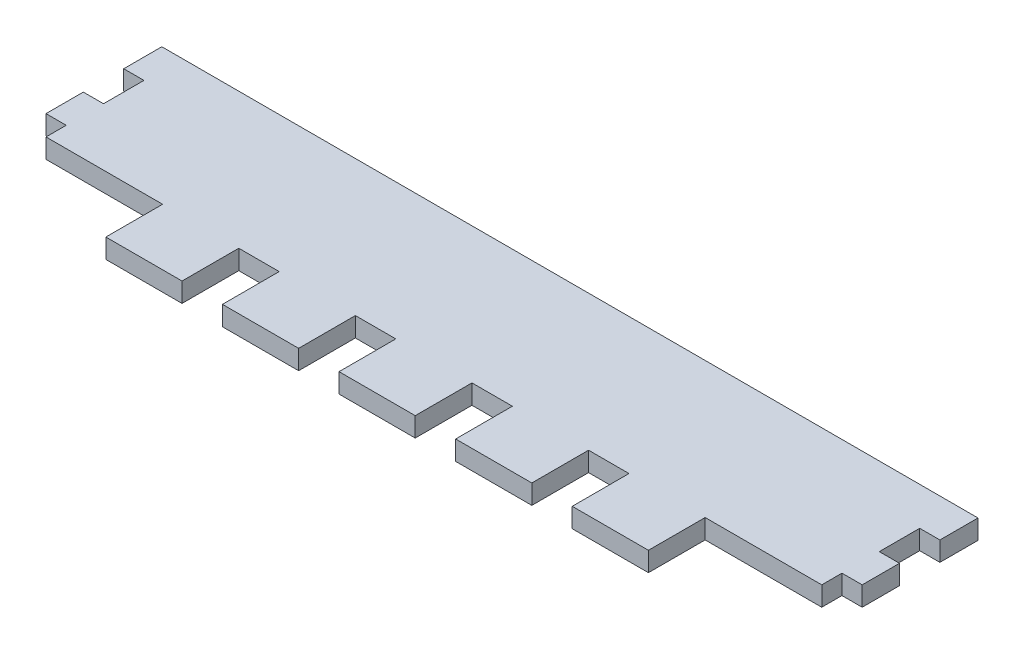
from build123d import *

# Parameters (mm, degrees)
SKETCH1_W           = 266.7
SKETCH1_H           = 57.15
BOSS_EXTRUDE1_DEPTH = 6.35
SKETCH3_W           = 24.892
SKETCH3_H           = 18.542
BOSS_EXTRUDE2_DEPTH = 6.35
SKETCH4_W           = 13.208
SKETCH4_H           = 13.208
CUT_EXTRUDE2_DEPTH  = 142.5717369
SKETCH5_W           = 295.464136086
SKETCH5_H           = 12.7
CUT_EXTRUDE3_DEPTH  = 142.5717369
SKETCH6_W           = 266.7
SKETCH6_H           = 12.446
BOSS_EXTRUDE3_DEPTH = 6.35


with BuildPart() as part:
    # Sketch1 → Boss-Extrude1 (new body)
    with BuildSketch(Plane(origin=(0, 0, 0), x_dir=(1, 0, 0), z_dir=(0, 1, 0))):
        Rectangle(SKETCH1_W, SKETCH1_H)
    extrude(amount=BOSS_EXTRUDE1_DEPTH)

    # Sketch3 → Boss-Extrude2 (add)
    with BuildSketch(Plane(origin=(0, 0, 0), x_dir=(1, 0, 0), z_dir=(0, 1, 0))):
        with Locations((-76.2, -37.846)):
            Rectangle(SKETCH3_W, SKETCH3_H)
        with Locations((-38.1, -37.846)):
            Rectangle(SKETCH3_W, SKETCH3_H)
        with Locations((0, -37.846)):
            Rectangle(SKETCH3_W, SKETCH3_H)
        with Locations((38.1, -37.846)):
            Rectangle(SKETCH3_W, SKETCH3_H)
        with Locations((76.2, -37.846)):
            Rectangle(SKETCH3_W, SKETCH3_H)
    extrude(amount=BOSS_EXTRUDE2_DEPTH)

    # Sketch4 → Cut-Extrude2 (cut, through all)
    with BuildSketch(Plane(origin=(0, 0, 0), x_dir=(1, 0, 0), z_dir=(0, 1, 0))):
        with Locations((-133.35, 22.225)):
            Rectangle(SKETCH4_W, SKETCH4_H)
        with Locations((133.35, 22.225)):
            Rectangle(SKETCH4_W, SKETCH4_H)
        with Locations((-133.35, -3.175)):
            Rectangle(SKETCH4_W, SKETCH4_H)
        with Locations((-133.35, -28.575)):
            Rectangle(SKETCH4_W, SKETCH4_H)
        with Locations((133.35, -3.175)):
            Rectangle(SKETCH4_W, SKETCH4_H)
        with Locations((133.35, -28.575)):
            Rectangle(SKETCH4_W, SKETCH4_H)
    extrude(amount=CUT_EXTRUDE2_DEPTH, mode=Mode.SUBTRACT)

    # Sketch5 → Cut-Extrude3 (cut, through all)
    with BuildSketch(Plane(origin=(0, 6.35, 0), x_dir=(1, 0, 0), z_dir=(0, 1, 0))):
        with Locations((7.963252738, 22.225)):
            Rectangle(SKETCH5_W, SKETCH5_H)
    extrude(amount=-CUT_EXTRUDE3_DEPTH, mode=Mode.SUBTRACT)

    # Sketch6 → Boss-Extrude3 (add)
    with BuildSketch(Plane(origin=(0, 6.35, 0), x_dir=(1, 0, 0), z_dir=(0, 1, 0))):
        with Locations((0, 9.652)):
            Rectangle(SKETCH6_W, SKETCH6_H)
    extrude(amount=-BOSS_EXTRUDE3_DEPTH)


solid = part.part
